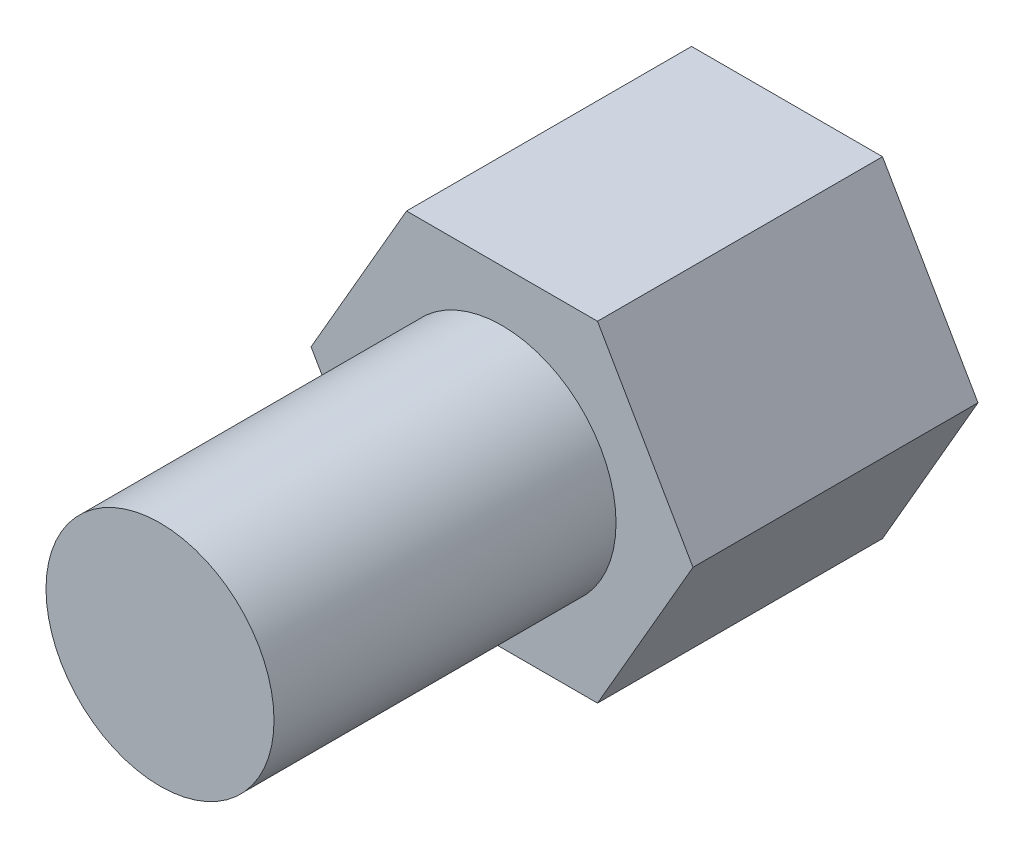
from build123d import *

# Parameters (mm, degrees)
EXTRUDE_1_DEPTH     = 5
SKETCH_2_R          = 2
EXTRUDE_2_DEPTH     = 6
SKETCH_3_R          = 1.65
CUT_EXTRUDE_1_DEPTH = 3


with BuildPart() as part:
    # 草圖1 → 填料-伸長1 (new body)
    with BuildSketch(Plane.XY):
        Polygon((-1.675, 2.901185103), (-3.35, 0), (-1.675, -2.901185103), (1.675, -2.901185103), (3.35, 0), (1.675, 2.901185103), align=None)
    extrude(amount=EXTRUDE_1_DEPTH)

    # 草圖2 → 填料-伸長2 (add)
    with BuildSketch(Plane.XY.offset(5)):
        Circle(SKETCH_2_R)
    extrude(amount=EXTRUDE_2_DEPTH)

    # 草圖3 → 除料-伸長1 (cut)
    with BuildSketch(Plane(origin=(0, 0, 0), x_dir=(-1, 0, 0), z_dir=(0, 0, -1))):
        Circle(SKETCH_3_R)
    extrude(amount=-CUT_EXTRUDE_1_DEPTH, mode=Mode.SUBTRACT)


solid = part.part
